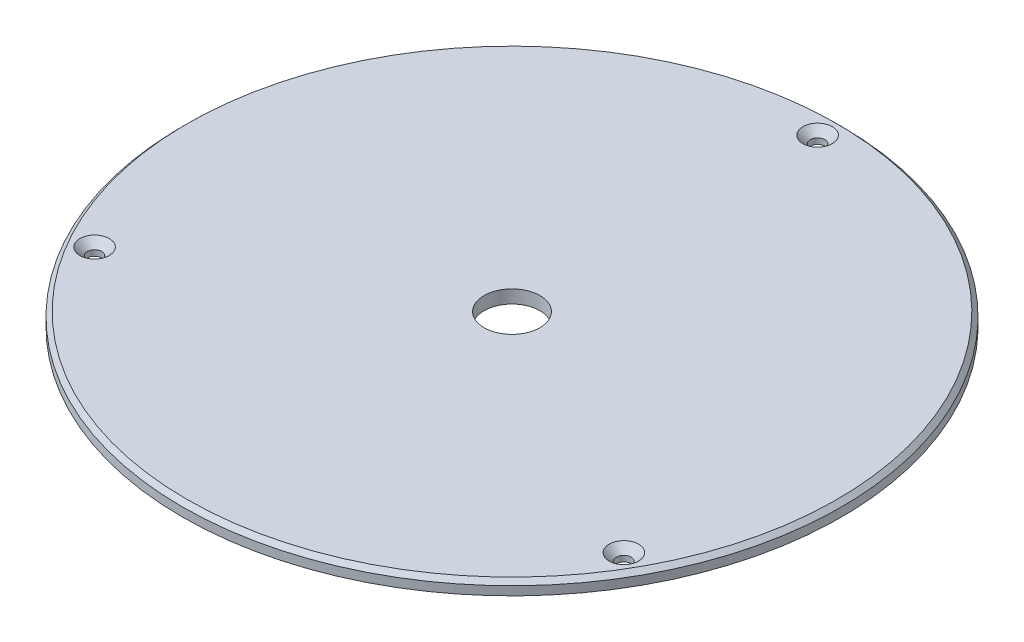
from build123d import *

# Parameters (mm, degrees)
SKETCH_1_R                           = 75
EXTRUDE_1_DEPTH                      = 3
SKETCH_2_R                           = 1.65
CUT_EXTRUDE_1_DEPTH                  = 107.108435103
CHAMFER_1_SIZE                       = 1.7
PATTERN_CIRCULAR_1_COUNT             = 3
CHAMFER_1_OF_PATTERN_CIRCULAR_1_SIZE = 1.7
SKETCH_3_R                           = 6.35
CUT_EXTRUDE_2_DEPTH                  = 107.108435103
CHAMFER_2_SIZE                       = 1


with BuildPart() as part:
    # Эскиз1 → Бобышка-Вытянуть1 (new body)
    with BuildSketch(Plane(origin=(0, 0, 0), x_dir=(1, 0, 0), z_dir=(0, 1, 0))):
        with Locations(Location((0, 0, 0), (0, 0, 270))):
            Circle(SKETCH_1_R)
    extrude(amount=EXTRUDE_1_DEPTH)

    # Эскиз2 → Вырез-Вытянуть1 (cut, through all)
    with BuildSketch(Plane(origin=(0, 3, 0), x_dir=(1, 0, 0), z_dir=(0, 1, 0))):
        with Locations(Location((0, 69.55, 0), (0, 0, 270))):
            Circle(SKETCH_2_R)
    cut_extrude_1 = extrude(amount=-CUT_EXTRUDE_1_DEPTH, mode=Mode.SUBTRACT)

    # Фаска1
    chamfer_1_edges = [part.edges().sort_by_distance(p)[0] for p in [
        (0, 3, -71.2),
    ]]
    chamfer(chamfer_1_edges, length=CHAMFER_1_SIZE)

    # Круговой массив1: Вырез-Вытянуть1 ×3 about axis
    pattern_circular_1_axis = Axis((0, 0, 0), (0, 1, 0))
    for i in range(1, PATTERN_CIRCULAR_1_COUNT):
        add(cut_extrude_1.rotate(pattern_circular_1_axis, i * 360 / PATTERN_CIRCULAR_1_COUNT), mode=Mode.SUBTRACT)

    # Фаска1 of Круговой массив1
    chamfer_1_of_pattern_circular_1_edges = [part.edges().sort_by_distance(p)[0] for p in [
        (-61.661008749, 3, 35.6),
        (61.661008749, 3, 35.6),
    ]]
    chamfer(chamfer_1_of_pattern_circular_1_edges, length=CHAMFER_1_OF_PATTERN_CIRCULAR_1_SIZE)

    # Эскиз3 → Вырез-Вытянуть2 (cut, through all)
    with BuildSketch(Plane(origin=(0, 3, 0), x_dir=(1, 0, 0), z_dir=(0, 1, 0))):
        with Locations(Location((0, 0, 0), (0, 0, 270))):
            Circle(SKETCH_3_R)
    extrude(amount=-CUT_EXTRUDE_2_DEPTH, mode=Mode.SUBTRACT)

    # Фаска2
    chamfer_2_edges = [part.edges().sort_by_distance(p)[0] for p in [
        (0, 3, -75),
    ]]
    chamfer(chamfer_2_edges, length=CHAMFER_2_SIZE)


solid = part.part
